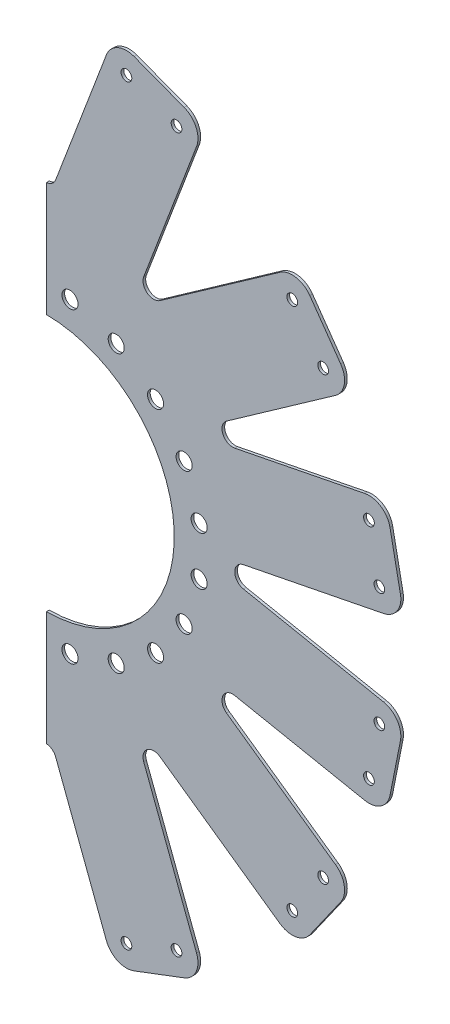
from build123d import *

# Parameters (mm, degrees)
SKETCH1_R          = 6.35
BASE_EXTRUDE_DEPTH = 1.5875
SKETCH4_R          = 9.525
CUT_EXTRUDE1_DEPTH = 632.57042153


with BuildPart() as part:
    # Sketch1 → Base-Extrude (new, symmetric)
    with BuildSketch(Plane.XY):
        with BuildLine():
            Line((1.016, 288.028470779), (1.016, 152.396613296))
            ThreePointArc((1.016, 152.396613296), (108.121687001, 107.40326252), (152.4, 0))
            Line((152.4, 0), (224.08509271, 0))
            ThreePointArc((224.08509271, 0), (226.970303426, 8.05977117), (234.315000004, 12.45747334))
            Line((234.315000004, 12.45747334), (400.41570649, 45.392253319))
            ThreePointArc((400.41570649, 45.392253319), (416.586287434, 56.182910854), (420.390467759, 75.247385412))
            Line((420.390467759, 75.247385412), (408.040004229, 137.534752113))
            ThreePointArc((408.040004229, 137.534752113), (397.249346694, 153.705333057), (378.184872136, 157.509513382))
            Line((378.184872136, 157.509513382), (224.103045939, 126.957861002))
            ThreePointArc((224.103045939, 126.957861002), (209.958830275, 134.414849048), (214.319609154, 149.79825293))
            Line((214.319609154, 149.79825293), (343.449482538, 240.752562825))
            ThreePointArc((343.449482538, 240.752562825), (353.849089047, 257.177366098), (349.588631557, 276.145088156))
            Line((349.588631557, 276.145088156), (313.021911166, 328.059681094))
            ThreePointArc((313.021911166, 328.059681094), (296.597107893, 338.459287603), (277.629385835, 334.198830112))
            Line((277.629385835, 334.198830112), (135.364166743, 233.992468211))
            ThreePointArc((135.364166743, 233.992468211), (120.264827781, 234.342028255), (116.177210875, 248.881753745))
            Line((116.177210875, 248.881753745), (178.82248253, 413.942798461))
            ThreePointArc((178.82248253, 413.942798461), (178.240047031, 433.374389929), (164.087992844, 446.702755935))
            Line((164.087992844, 446.702755935), (104.719933894, 469.234590669))
            ThreePointArc((104.719933894, 469.234590669), (85.288342425, 468.65215517), (71.95997642, 454.500100983))
            Line((71.95997642, 454.500100983), (11.87361179, 296.181398599))
            ThreePointArc((11.87361179, 296.181398599), (7.625816745, 290.532130708), (1.016, 288.028470779))
        make_face()
        with Locations((395.475521078, 70.3072)):
            Circle(SKETCH1_R, mode=Mode.SUBTRACT)
        with Locations((383.125057548, 132.594566701)):
            Circle(SKETCH1_R, mode=Mode.SUBTRACT)
        with Locations((328.822794382, 261.5184)):
            Circle(SKETCH1_R, mode=Mode.SUBTRACT)
        with Locations((292.256073991, 313.432992937)):
            Circle(SKETCH1_R, mode=Mode.SUBTRACT)
        with Locations((155.07525895, 422.955532355)):
            Circle(SKETCH1_R, mode=Mode.SUBTRACT)
        with Locations((95.7072, 445.487367089)):
            Circle(SKETCH1_R, mode=Mode.SUBTRACT)
    base_extrude = extrude(amount=BASE_EXTRUDE_DEPTH, both=True)

    # Sketch4 → Cut-Extrude1 (cut, through all)
    with BuildSketch(Plane.XY.offset(1.5875)):
        with Locations((181.882606251, 28.80868)):
            Circle(SKETCH4_R)
        with Locations((164.07826617, 83.603499153)):
            Circle(SKETCH4_R)
        with Locations((130.212802196, 130.214625308)):
            Circle(SKETCH4_R)
        with Locations((83.601201897, 164.07943668)):
            Circle(SKETCH4_R)
        with Locations((28.806133473, 181.883009581)):
            Circle(SKETCH4_R)
    cut_extrude1 = extrude(amount=-CUT_EXTRUDE1_DEPTH, mode=Mode.SUBTRACT)

    # Mirror1: Base-Extrude, Cut-Extrude1 across plane
    add(base_extrude.mirror(Plane.ZX))
    add(cut_extrude1.mirror(Plane.ZX), mode=Mode.SUBTRACT)


solid = part.part
